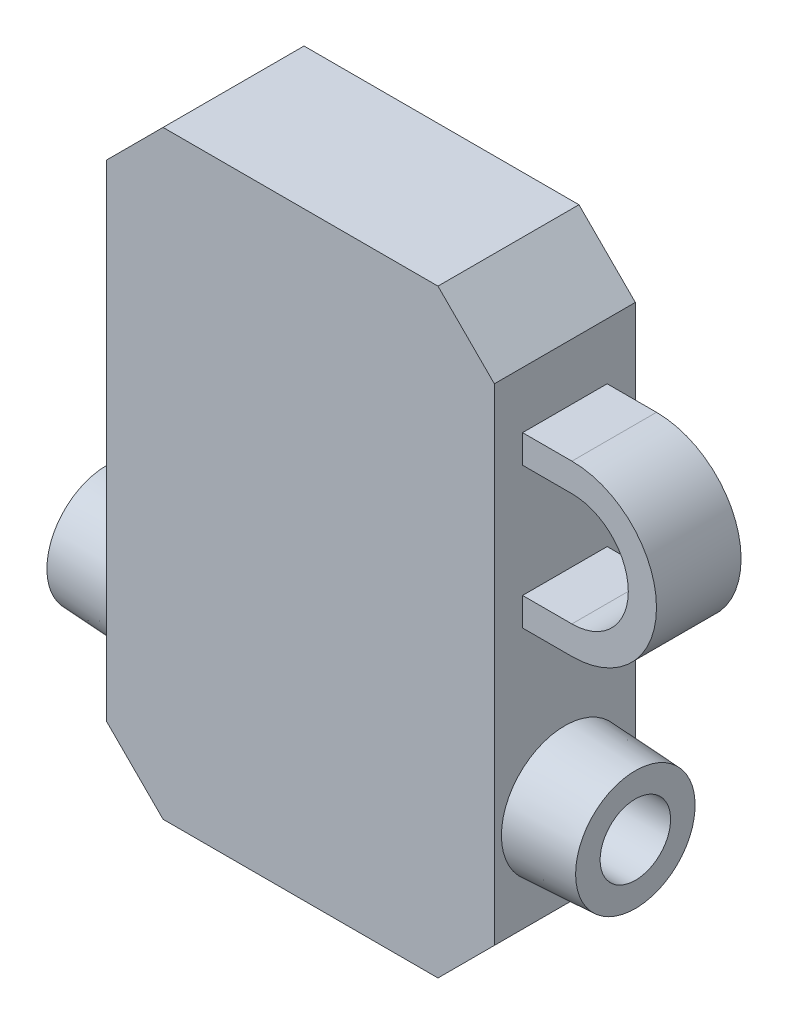
from build123d import *

# Parameters (mm, degrees)
EXTRUDE_1_DEPTH      = 10
EXTRUDE_2_DEPTH      = 5
EXTRUDE_2_DEPTH_BACK = 32.5
SKETCH_2_R           = 4.5
SKETCH_2_R_2         = 2.5
DRAFT_1_ANGLE        = 3
DRAFT_2_ANGLE        = 3
EXTRUDE_3_DEPTH      = 3
EXTRUDE_3_DEPTH_BACK = 3


with BuildPart() as part:
    # 草图1 → 凸台-拉伸1 (new body)
    with BuildSketch(Plane.XY):
        Polygon((0, 38.5), (4, 42.5), (23.5, 42.5), (27.5, 38.5), (27.5, 4), (23.5, 0), (4, 0), (0, 4), align=None)
    extrude(amount=EXTRUDE_1_DEPTH)

    # 草图2 → 凸台-拉伸2 (add, two sides: drawn at the far end of the back side and taken through both)
    with BuildSketch(Plane.ZY.offset(-EXTRUDE_2_DEPTH_BACK)):
        with Locations((5, 10.5)):
            Circle(SKETCH_2_R)
        with Locations((5, 10.5)):
            Circle(SKETCH_2_R_2, mode=Mode.SUBTRACT)
    extrude(amount=EXTRUDE_2_DEPTH + EXTRUDE_2_DEPTH_BACK)

    # 拔模1
    draft_1_faces = [part.faces().sort_by_distance(p)[0] for p in [
        (30, 10.5, 0.5),
    ]]
    draft(draft_1_faces, Plane(origin=(27.5, 4, 10), x_dir=(0, 0, 1), z_dir=(1, 0, 0)), DRAFT_1_ANGLE)

    # 拔模2
    draft_2_faces = [part.faces().sort_by_distance(p)[0] for p in [
        (-2.5, 10.5, 0.5),
    ]]
    draft(draft_2_faces, Plane(origin=(0, 4, 10), x_dir=(0, 0, -1), z_dir=(-1, 0, 0)), DRAFT_2_ANGLE)

    # 草图3 → 凸台-拉伸3 (add, two sides: drawn at the far end of the back side and taken through both)
    with BuildSketch(Plane.XY.offset(5).offset(-EXTRUDE_3_DEPTH_BACK)):
        with BuildLine():
            Line((31, 34.5), (25.5, 34.5))
            Line((25.5, 34.5), (25.5, 22.5))
            Line((25.5, 22.5), (31, 22.5))
            ThreePointArc((31, 22.5), (37, 28.5), (31, 34.5))
        make_face()
        with BuildLine():
            Line((31, 32.5), (27.5, 32.5))
            Line((27.5, 32.5), (27.5, 24.5))
            Line((27.5, 24.5), (31, 24.5))
            ThreePointArc((31, 24.5), (35, 28.5), (31, 32.5))
        make_face(mode=Mode.SUBTRACT)
    extrude(amount=EXTRUDE_3_DEPTH + EXTRUDE_3_DEPTH_BACK)


solid = part.part
